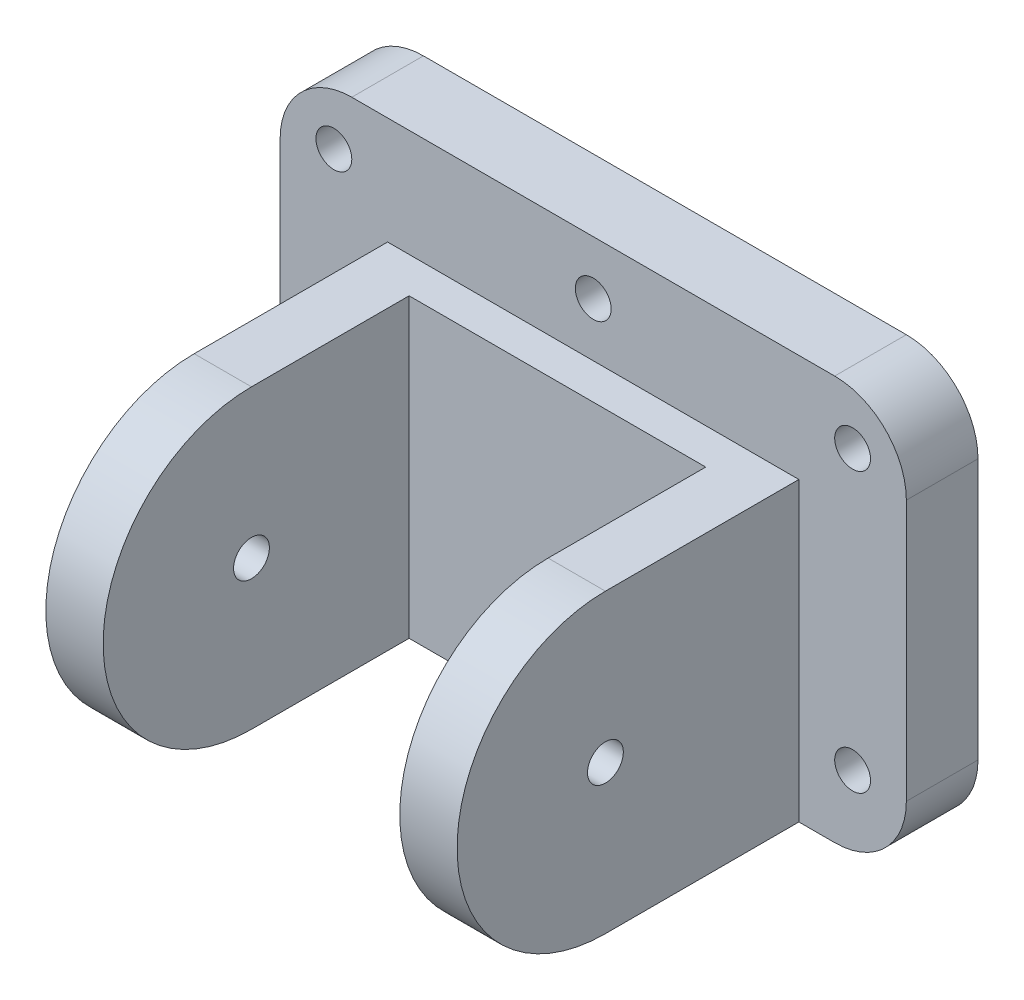
from build123d import *

# Parameters (mm, degrees)
SKETCH1_W           = 57.4
SKETCH1_H           = 41.4
BOSS_EXTRUDE1_DEPTH = 10
SKETCH2_W           = 57.4
SKETCH2_H           = 41.4
BOSS_EXTRUDE2_DEPTH = 5
BOSS_EXTRUDE3_DEPTH = 8
BOSS_EXTRUDE4_START = -8
BOSS_EXTRUDE4_DEPTH = 8
CUT_EXTRUDE1_REACH  = 85.979
SKETCH6_R           = 2.5
SKETCH11_W          = 10
SKETCH11_H          = 41.4
BOSS_EXTRUDE5_DEPTH = 15
SKETCH12_W          = 10
SKETCH12_H          = 41.4
BOSS_EXTRUDE6_DEPTH = 15
SKETCH13_W          = 87.4
SKETCH13_H          = 10
BOSS_EXTRUDE7_DEPTH = 15
SKETCH14_R          = 2.5
CUT_EXTRUDE2_DEPTH  = 10
FILLET1_R           = 10


with BuildPart() as part:
    # Sketch1 → Boss-Extrude1 (new body)
    with BuildSketch(Plane.XY):
        Rectangle(SKETCH1_W, SKETCH1_H)
    extrude(amount=BOSS_EXTRUDE1_DEPTH)

    # Sketch2 → Boss-Extrude2 (add)
    with BuildSketch(Plane.XY.offset(10)):
        Rectangle(SKETCH2_W, SKETCH2_H)
    extrude(amount=BOSS_EXTRUDE2_DEPTH)

    # Sketch4 → Boss-Extrude3 (add)
    with BuildSketch(Plane(origin=(28.7, 0, 0), x_dir=(0, 0, -1), z_dir=(1, 0, 0))):
        with BuildLine():
            Line((-15, -20.7), (-15, 20.7))
            Line((-15, 20.7), (-37, 20.7))
            ThreePointArc((-37, 20.7), (-57.7, 0), (-37, -20.7))
            Line((-37, -20.7), (-15, -20.7))
        make_face()
    extrude(amount=-BOSS_EXTRUDE3_DEPTH)

    # Sketch5 → Boss-Extrude4 (add)
    with BuildSketch(Plane.ZY.offset(28.7).offset(BOSS_EXTRUDE4_START)):
        with BuildLine():
            Line((15, 20.7), (15, -20.7))
            Line((15, -20.7), (37, -20.7))
            ThreePointArc((37, -20.7), (57.7, 0), (37, 20.7))
            Line((37, 20.7), (15, 20.7))
        make_face()
    extrude(amount=BOSS_EXTRUDE4_DEPTH)

    # Cut-Extrude1: up to this face of the body (flat: up to its plane)
    cut_extrude1_end = Plane(part.part.faces().sort_by_distance((-28.7, 0, 26.829272143))[0])
    # Sketch6 → Cut-Extrude1 (cut, up to the picked face)
    with BuildSketch(Plane(origin=(28.7, 0, 0), x_dir=(0, 0, -1), z_dir=(1, 0, 0)), mode=Mode.PRIVATE) as cut_extrude1_sk1:
        with Locations((-37, 0)):
            Circle(SKETCH6_R)
    cut_extrude1_tool1 = split(extrude(cut_extrude1_sk1.sketch, amount=-CUT_EXTRUDE1_REACH, mode=Mode.PRIVATE), bisect_by=cut_extrude1_end, keep=Keep.BOTH, mode=Mode.PRIVATE)
    add(cut_extrude1_tool1.solids().sort_by(Axis((28.7, 0, 37), (-1, 0, 0)))[0], mode=Mode.SUBTRACT)

    # Sketch11 → Boss-Extrude5 (add)
    with BuildSketch(Plane.ZY.offset(28.7)):
        with Locations((5, 0)):
            Rectangle(SKETCH11_W, SKETCH11_H)
    extrude(amount=BOSS_EXTRUDE5_DEPTH)

    # Sketch12 → Boss-Extrude6 (add)
    with BuildSketch(Plane(origin=(28.7, 0, 0), x_dir=(0, 0, -1), z_dir=(1, 0, 0))):
        with Locations((-5, 0)):
            Rectangle(SKETCH12_W, SKETCH12_H)
    extrude(amount=BOSS_EXTRUDE6_DEPTH)

    # Sketch13 → Boss-Extrude7 (add)
    with BuildSketch(Plane(origin=(0, 20.7, 0), x_dir=(1, 0, 0), z_dir=(0, 1, 0))):
        with Locations((0, -5)):
            Rectangle(SKETCH13_W, SKETCH13_H)
    extrude(amount=BOSS_EXTRUDE7_DEPTH)

    # Sketch14 → Cut-Extrude2 (cut)
    with BuildSketch(Plane.XY.offset(10)):
        with Locations((-36.2, -10.7)):
            Circle(SKETCH14_R)
        with Locations((-36.2, 28.2)):
            Circle(SKETCH14_R)
        with Locations((36.2, 28.2)):
            Circle(SKETCH14_R)
        with Locations((36.2, -10.7)):
            Circle(SKETCH14_R)
        with Locations((0, 28.2)):
            Circle(SKETCH14_R)
    extrude(amount=-CUT_EXTRUDE2_DEPTH, mode=Mode.SUBTRACT)

    # Fillet1
    fillet1_edges = [part.edges().sort_by_distance(p)[0] for p in [
        (-43.7, -20.7, 5),
        (43.7, -20.7, 5),
        (-43.7, 35.7, 5),
        (43.7, 35.7, 5),
    ]]
    fillet(fillet1_edges, radius=FILLET1_R)


solid = part.part
